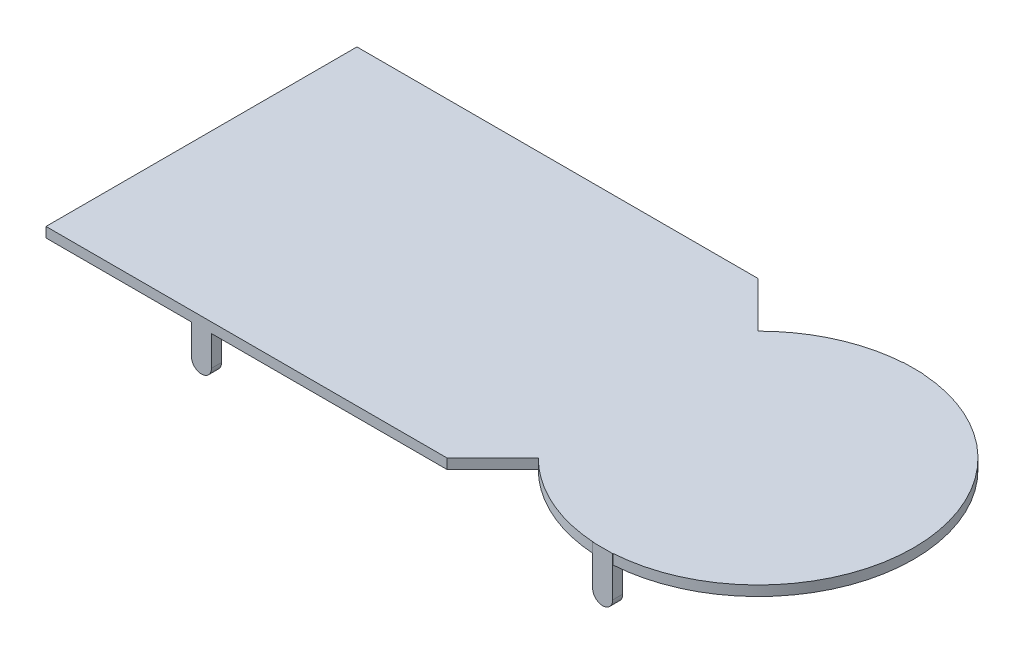
from build123d import *

# Parameters (mm, degrees)
BOSS_EXTRUDE2_DEPTH = 10
BOSS_EXTRUDE3_DEPTH = 310
SKETCH7_W           = 290
SKETCH7_H           = 40
CUT_EXTRUDE1_DEPTH  = 589


with BuildPart() as part:
    # Sketch2 → Boss-Extrude2 (new body)
    with BuildSketch(Plane(origin=(0, 0, 0), x_dir=(1, 0, 0), z_dir=(0, 1, 0))):
        with BuildLine():
            Line((200, 155), (245.398448916, 109.601551084))
            ThreePointArc((245.398448916, 109.601551084), (510, 0), (245.398448916, -109.601551084))
            Line((245.398448916, -109.601551084), (200, -155))
            Line((200, -155), (-200, -155))
            Line((-200, -155), (-200, 155))
            Line((-200, 155), (200, 155))
        make_face()
    extrude(amount=BOSS_EXTRUDE2_DEPTH)

    # Sketch6 → Boss-Extrude3 (add)
    with BuildSketch(Plane.XY.offset(155)):
        with BuildLine():
            Line((-35, 10), (-55, 10))
            Line((-55, 10), (-55, -30))
            ThreePointArc((-55, -30), (-45, -40), (-35, -30))
            Line((-35, -30), (-35, 10))
        make_face()
        with BuildLine():
            Line((365, 10), (345, 10))
            Line((345, 10), (345, -30))
            ThreePointArc((345, -30), (355, -40), (365, -30))
            Line((365, -30), (365, 10))
        make_face()
    extrude(amount=-BOSS_EXTRUDE3_DEPTH)

    # Sketch7 → Cut-Extrude1 (cut)
    with BuildSketch(Plane.ZY.offset(55)):
        with Locations((0, -20)):
            Rectangle(SKETCH7_W, SKETCH7_H)
    extrude(amount=-CUT_EXTRUDE1_DEPTH, mode=Mode.SUBTRACT)


solid = part.part
